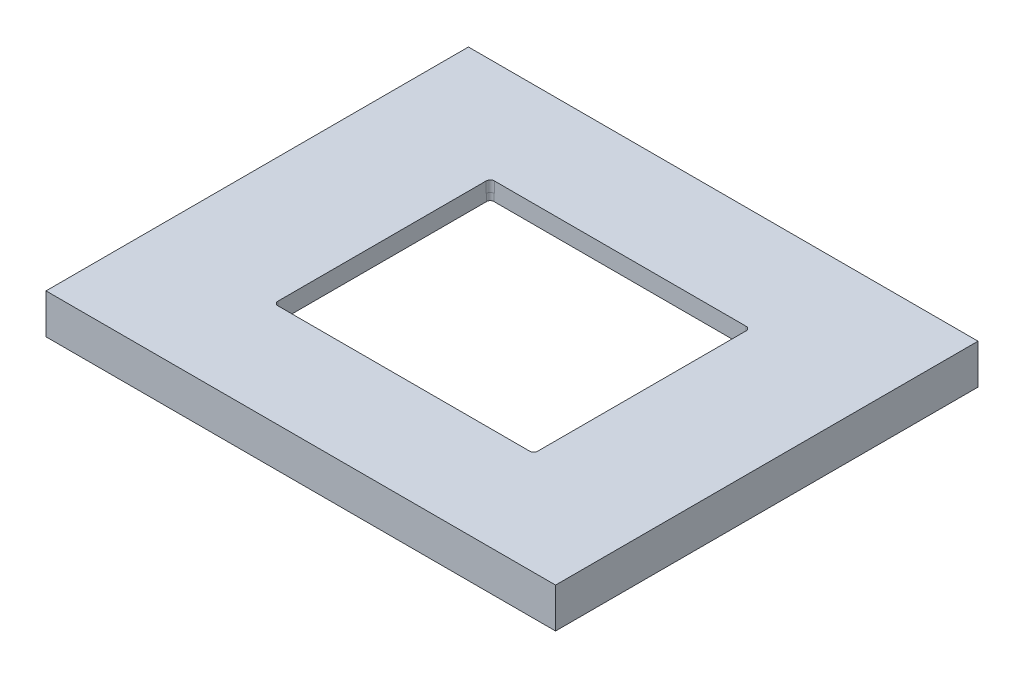
from build123d import *

# Parameters (mm, degrees)
SKETCH1_W           = 70.41
SKETCH1_H           = 58.37
SKETCH1_W_2         = 66.41
SKETCH1_H_2         = 54.37
BOSS_EXTRUDE1_DEPTH = 4
SKETCH2_W           = 70.41
SKETCH2_H           = 58.37
SKETCH2_W_2         = 35.9
SKETCH2_H_2         = 29.9
BOSS_EXTRUDE2_DEPTH = 1.5
FILLET1_R           = 0.56
BOSS_EXTRUDE3_DEPTH = 1


with BuildPart() as part:
    # Sketch1 → Boss-Extrude1 (new body)
    with BuildSketch(Plane(origin=(0, 0, 0), x_dir=(1, 0, 0), z_dir=(0, 1, 0))):
        Rectangle(SKETCH1_W, SKETCH1_H)
        Rectangle(SKETCH1_W_2, SKETCH1_H_2, mode=Mode.SUBTRACT)
    extrude(amount=BOSS_EXTRUDE1_DEPTH)

    # Sketch2 → Boss-Extrude2 (add)
    with BuildSketch(Plane(origin=(0, 4, 0), x_dir=(1, 0, 0), z_dir=(0, 1, 0))):
        Rectangle(SKETCH2_W, SKETCH2_H)
        Rectangle(SKETCH2_W_2, SKETCH2_H_2, mode=Mode.SUBTRACT)
    extrude(amount=BOSS_EXTRUDE2_DEPTH)

    # Fillet1
    fillet1_edges = [part.edges().sort_by_distance(p)[0] for p in [
        (17.95, 4.75, -14.95),
        (-17.95, 4.75, -14.95),
        (-17.95, 4.75, 14.95),
        (17.95, 4.75, 14.95),
    ]]
    fillet(fillet1_edges, radius=FILLET1_R)

    # Sketch3 → Boss-Extrude3 (add)
    with BuildSketch(Plane.XZ.offset(-4)):
        with BuildLine():
            Line((18.95, -14.45), (18.95, 14.45))
            ThreePointArc((18.95, 14.45), (18.510660172, 15.510660172), (17.45, 15.95))
            Line((17.45, 15.95), (-17.45, 15.95))
            ThreePointArc((-17.45, 15.95), (-18.510660172, 15.510660172), (-18.95, 14.45))
            Line((-18.95, 14.45), (-18.95, -14.45))
            ThreePointArc((-18.95, -14.45), (-18.510660172, -15.510660172), (-17.45, -15.95))
            Line((-17.45, -15.95), (17.45, -15.95))
            ThreePointArc((17.45, -15.95), (18.510660172, -15.510660172), (18.95, -14.45))
        make_face()
        with BuildLine():
            Line((17.45, -14.95), (-17.45, -14.95))
            ThreePointArc((-17.45, -14.95), (-17.803553391, -14.803553391), (-17.95, -14.45))
            Line((-17.95, -14.45), (-17.95, 14.45))
            ThreePointArc((-17.95, 14.45), (-17.803553391, 14.803553391), (-17.45, 14.95))
            Line((-17.45, 14.95), (17.45, 14.95))
            ThreePointArc((17.45, 14.95), (17.803553391, 14.803553391), (17.95, 14.45))
            Line((17.95, 14.45), (17.95, -14.45))
            ThreePointArc((17.95, -14.45), (17.803553391, -14.803553391), (17.45, -14.95))
        make_face(mode=Mode.SUBTRACT)
    extrude(amount=BOSS_EXTRUDE3_DEPTH)


solid = part.part
